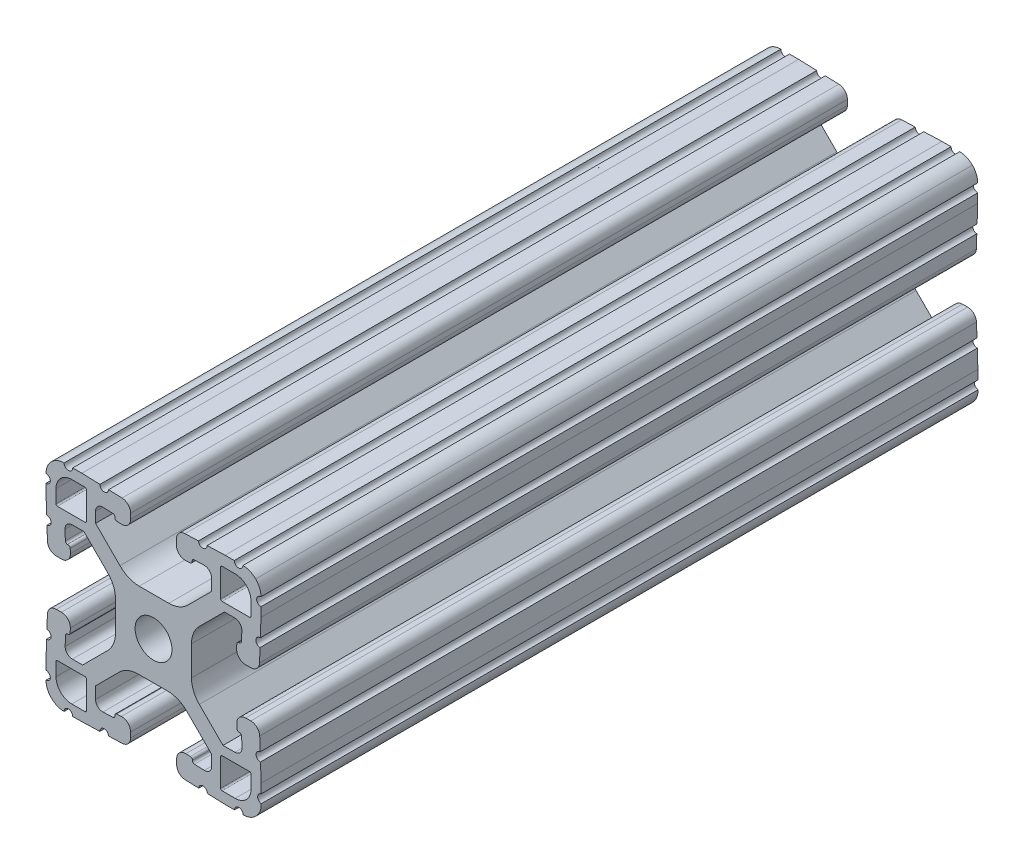
from build123d import *

# Parameters (mm, degrees)
SKETCH1_R           = 3.2639
BOSS_EXTRUDE1_DEPTH = 127


with BuildPart() as part:
    # Sketch1 → Boss-Extrude1 (new body)
    with BuildSketch(Plane(origin=(0, 0, -25.4), x_dir=(-1, 0, 0), z_dir=(0, 0, -1))):
        with BuildLine():
            Line((-88.043721549, 91.862643967), (-86.29674679, 91.923648859))
            ThreePointArc((-86.29674679, 91.923648859), (-85.370208675, 91.567983831), (-84.982425017, 90.654422489))
            Line((-84.982425017, 90.654422489), (-84.982425017, 88.800173916))
            Line((-84.982425017, 88.800173916), (-89.306565884, 84.476033049))
            ThreePointArc((-89.306565884, 84.476033049), (-90.866149908, 83.406077005), (-92.719610366, 83.029523439))
            Line((-92.719610366, 83.029523439), (-97.961628589, 83.029523439))
            ThreePointArc((-97.961628589, 83.029523439), (-99.779298356, 83.391080435), (-101.320244378, 84.42070765))
            Line((-101.320244378, 84.42070765), (-105.516001761, 88.616465033))
            Line((-105.516001761, 88.616465033), (-105.516001761, 90.731330035))
            ThreePointArc((-105.516001761, 90.731330035), (-105.128218103, 91.644891377), (-104.201679988, 92.000556406))
            Line((-104.201679988, 92.000556406), (-102.454705229, 91.939551513))
            ThreePointArc((-102.454705229, 91.939551513), (-102.193933359, 91.823448504), (-102.087001761, 91.558783602))
            ThreePointArc((-102.087001761, 91.558783602), (-102.010859042, 91.249291513), (-101.726191901, 91.105946874))
            Line((-101.726191901, 91.105946874), (-100.929727576, 91.078102142))
            ThreePointArc((-100.929727576, 91.078102142), (-99.780779944, 91.519102656), (-99.299905511, 92.651940638))
            Line((-99.299905511, 92.651940638), (-99.299905511, 93.566848638))
            ThreePointArc((-99.299905511, 93.566848638), (-99.741889517, 94.660796975), (-100.819746715, 95.140689345))
            Line((-100.819746715, 95.140689345), (-103.211918901, 95.224224422))
            ThreePointArc((-103.211918901, 95.224224422), (-104.000045777, 94.489281495), (-104.734990687, 95.277406522))
            Line((-104.734990687, 95.277406522), (-107.935905676, 95.389166912))
            Line((-107.935905676, 95.389166912), (-109.561454876, 95.389166912))
            ThreePointArc((-109.561454876, 95.389166912), (-110.323454876, 94.627166912), (-111.085454876, 95.389166912))
            ThreePointArc((-111.085454876, 95.389166912), (-112.308767787, 95.144035599), (-113.343184761, 94.446493225))
            ThreePointArc((-113.343184761, 94.446493225), (-114.04072548, 93.412075135), (-114.285854836, 92.188761832))
            ThreePointArc((-114.285854836, 92.188761832), (-113.523853616, 91.426762441), (-114.285853616, 90.664761832))
            Line((-114.285853616, 90.664761832), (-114.285853616, 89.039212632))
            Line((-114.285853616, 89.039212632), (-114.174093219, 85.838297643))
            ThreePointArc((-114.174093219, 85.838297643), (-113.385968191, 85.103352735), (-114.120911115, 84.315225857))
            Line((-114.120911115, 84.315225857), (-114.037376031, 81.923053667))
            ThreePointArc((-114.037376031, 81.923053667), (-113.55748366, 80.845196472), (-112.463535325, 80.403212468))
            Line((-112.463535325, 80.403212468), (-111.548627325, 80.403212468))
            ThreePointArc((-111.548627325, 80.403212468), (-110.415788905, 80.884087354), (-109.974788872, 82.033035791))
            Line((-109.974788872, 82.033035791), (-110.002634241, 82.829500094))
            ThreePointArc((-110.002634241, 82.829500094), (-110.118742417, 83.090261917), (-110.383401914, 83.197188))
            ThreePointArc((-110.383401914, 83.197188), (-110.693757401, 83.272605688), (-110.837665276, 83.557735272))
            Line((-110.837665276, 83.557735272), (-110.898671566, 85.304709982))
            ThreePointArc((-110.898671566, 85.304709982), (-110.543006925, 86.231248747), (-109.62944523, 86.61903277))
            Line((-109.62944523, 86.61903277), (-107.807161806, 86.61903277))
            Line((-107.807161806, 86.61903277), (-103.364925613, 82.176810793))
            ThreePointArc((-103.364925613, 82.176810793), (-102.335294479, 80.635862907), (-101.973736029, 78.81818963))
            Line((-101.973736029, 78.81818963), (-101.973736029, 73.576034207))
            ThreePointArc((-101.973736029, 73.576034207), (-102.335293752, 71.758362684), (-103.364922926, 70.21741573))
            Line((-103.364922926, 70.21741573), (-107.560683666, 66.021661704))
            Line((-107.560683666, 66.021661704), (-109.652436558, 66.021661704))
            ThreePointArc((-109.652436558, 66.021661704), (-110.565998503, 66.409445617), (-110.921663765, 67.335984343))
            Line((-110.921663765, 67.335984343), (-110.860658873, 69.082959102))
            ThreePointArc((-110.860658873, 69.082959102), (-110.744555864, 69.343730973), (-110.479890961, 69.45066257))
            ThreePointArc((-110.479890961, 69.45066257), (-110.173494703, 69.529390272), (-110.032185196, 69.812424443))
            Line((-110.032185196, 69.812424443), (-110.004340464, 70.608888768))
            ThreePointArc((-110.004340464, 70.608888768), (-110.445340978, 71.7578364), (-111.57817896, 72.238710833))
            Line((-111.57817896, 72.238710833), (-112.49308696, 72.238710833))
            ThreePointArc((-112.49308696, 72.238710833), (-113.587035297, 71.796726827), (-114.066927667, 70.718869629))
            Line((-114.066927667, 70.718869629), (-114.150462744, 68.326697443))
            ThreePointArc((-114.150462744, 68.326697443), (-113.415519817, 67.538570567), (-114.203644843, 66.803625657))
            Line((-114.203644843, 66.803625657), (-114.315405233, 63.602710668))
            Line((-114.315405233, 63.602710668), (-114.315405233, 61.962557497))
            ThreePointArc((-114.315405233, 61.962557497), (-113.701927281, 61.206106537), (-114.333208228, 60.464447842))
            ThreePointArc((-114.333208228, 60.464447842), (-114.113020459, 59.176546471), (-113.392816136, 58.086372941))
            ThreePointArc((-113.392816136, 58.086372941), (-112.358398046, 57.388832223), (-111.135084743, 57.143702867))
            ThreePointArc((-111.135084743, 57.143702867), (-110.373085352, 57.905704086), (-109.611084743, 57.143704086))
            Line((-109.611084743, 57.143704086), (-107.985535543, 57.143704086))
            Line((-107.985535543, 57.143704086), (-104.784620554, 57.255464483))
            ThreePointArc((-104.784620554, 57.255464483), (-104.049675645, 58.04358951), (-103.261548768, 57.308646586))
            Line((-103.261548768, 57.308646586), (-100.869376578, 57.39218167))
            ThreePointArc((-100.869376578, 57.39218167), (-99.791519383, 57.872074041), (-99.349535378, 58.966022376))
            Line((-99.349535378, 58.966022376), (-99.349535378, 59.880930376))
            ThreePointArc((-99.349535378, 59.880930376), (-99.830409811, 61.013768358), (-100.979357443, 61.454768873))
            Line((-100.979357443, 61.454768873), (-101.775821768, 61.42692414))
            ThreePointArc((-101.775821768, 61.42692414), (-102.036583684, 61.310816174), (-102.143509978, 61.046156762))
            ThreePointArc((-102.143509978, 61.046156762), (-102.222494916, 60.740061862), (-102.505377386, 60.598958297))
            Line((-102.505377386, 60.598958297), (-104.252352145, 60.537953405))
            ThreePointArc((-104.252352145, 60.537953405), (-105.17889026, 60.893618433), (-105.566673918, 61.807179775))
            Line((-105.566673918, 61.807179775), (-105.566673918, 63.629462758))
            Line((-105.566673918, 63.629462758), (-101.131142468, 68.064994208))
            ThreePointArc((-101.131142468, 68.064994208), (-99.590196446, 69.094621422), (-97.772526678, 69.456178419))
            Line((-97.772526678, 69.456178419), (-92.530356056, 69.456178419))
            ThreePointArc((-92.530356056, 69.456178419), (-90.712686289, 69.094621422), (-89.171740267, 68.064994208))
            Line((-89.171740267, 68.064994208), (-84.975982884, 63.869236825))
            Line((-84.975982884, 63.869236825), (-84.975982884, 61.781050107))
            ThreePointArc((-84.975982884, 61.781050107), (-85.363766542, 60.867488765), (-86.290304657, 60.511823736))
            Line((-86.290304657, 60.511823736), (-88.037279416, 60.572828629))
            ThreePointArc((-88.037279416, 60.572828629), (-88.298051286, 60.688931638), (-88.404982884, 60.95359654))
            ThreePointArc((-88.404982884, 60.95359654), (-88.466593694, 61.278962759), (-88.759626911, 61.433204782))
            Line((-88.759626911, 61.433204782), (-89.556091237, 61.461049514))
            ThreePointArc((-89.556091237, 61.461049514), (-90.705038868, 61.020049), (-91.185913301, 59.887211018))
            Line((-91.185913301, 59.887211018), (-91.185913301, 58.972303018))
            ThreePointArc((-91.185913301, 58.972303018), (-90.743929295, 57.878354681), (-89.666072098, 57.398462311))
            Line((-89.666072098, 57.398462311), (-87.273899911, 57.314927234))
            ThreePointArc((-87.273899911, 57.314927234), (-86.485773036, 58.049870161), (-85.750828126, 57.261745135))
            Line((-85.750828126, 57.261745135), (-82.549913136, 57.149984745))
            Line((-82.549913136, 57.149984745), (-80.924363936, 57.149984745))
            ThreePointArc((-80.924363936, 57.149984745), (-80.162363936, 57.911984745), (-79.400363936, 57.149984745))
            ThreePointArc((-79.400363936, 57.149984745), (-78.177051025, 57.395116058), (-77.142634052, 58.092658432))
            ThreePointArc((-77.142634052, 58.092658432), (-76.445094372, 59.127074031), (-76.199963977, 60.350384428))
            ThreePointArc((-76.199963977, 60.350384428), (-76.961961268, 61.112385783), (-76.199961268, 61.874384428))
            Line((-76.199961268, 61.874384428), (-76.199961268, 63.499933628))
            Line((-76.199961268, 63.499933628), (-76.311721666, 66.700848617))
            ThreePointArc((-76.311721666, 66.700848617), (-77.099846694, 67.435793525), (-76.364903769, 68.223920403))
            Line((-76.364903769, 68.223920403), (-76.448438853, 70.616092593))
            ThreePointArc((-76.448438853, 70.616092593), (-76.928331225, 71.693949788), (-78.02227956, 72.135933792))
            Line((-78.02227956, 72.135933792), (-78.93718756, 72.135933792))
            ThreePointArc((-78.93718756, 72.135933792), (-80.07002598, 71.655058906), (-80.511026012, 70.506110469))
            Line((-80.511026012, 70.506110469), (-80.483180643, 69.709646166))
            ThreePointArc((-80.483180643, 69.709646166), (-80.367072468, 69.448884343), (-80.102412971, 69.34195826))
            ThreePointArc((-80.102412971, 69.34195826), (-79.796317908, 69.262973649), (-79.655214052, 68.980091239))
            Line((-79.655214052, 68.980091239), (-79.594207761, 67.233116529))
            ThreePointArc((-79.594207761, 67.233116529), (-79.949872402, 66.306577764), (-80.863434097, 65.918793741))
            Line((-80.863434097, 65.918793741), (-82.685717521, 65.918793741))
            Line((-82.685717521, 65.918793741), (-87.121258001, 70.35431293))
            ThreePointArc((-87.121258001, 70.35431293), (-88.150863946, 71.895196205), (-88.512450271, 73.712794894))
            Line((-88.512450271, 73.712794894), (-88.512606864, 78.954950317))
            ThreePointArc((-88.512606864, 78.954950317), (-88.151076291, 80.772698182), (-87.121419968, 82.313710679))
            Line((-87.121419968, 82.313710679), (-82.925659228, 86.509464706))
            Line((-82.925659228, 86.509464706), (-80.837473527, 86.509464706))
            ThreePointArc((-80.837473527, 86.509464706), (-79.923911584, 86.121680793), (-79.568246321, 85.195142068))
            Line((-79.568246321, 85.195142068), (-79.629251214, 83.448167309))
            ThreePointArc((-79.629251214, 83.448167309), (-79.745354223, 83.187395438), (-80.010019125, 83.080463841))
            ThreePointArc((-80.010019125, 83.080463841), (-80.335385344, 83.018853031), (-80.489627367, 82.725819813))
            Line((-80.489627367, 82.725819813), (-80.5174721, 81.929355488))
            ThreePointArc((-80.5174721, 81.929355488), (-80.076471586, 80.780407856), (-78.943633603, 80.299533423))
            Line((-78.943633603, 80.299533423), (-78.028725603, 80.299533423))
            ThreePointArc((-78.028725603, 80.299533423), (-76.934777267, 80.741517429), (-76.454884897, 81.819374627))
            Line((-76.454884897, 81.819374627), (-76.37134982, 84.211546813))
            ThreePointArc((-76.37134982, 84.211546813), (-77.106292747, 84.999673689), (-76.31816772, 85.734618599))
            Line((-76.31816772, 85.734618599), (-76.20640733, 88.935533588))
            Line((-76.20640733, 88.935533588), (-76.20640733, 90.561082788))
            ThreePointArc((-76.20640733, 90.561082788), (-76.96840733, 91.323083398), (-76.206406111, 92.085082788))
            ThreePointArc((-76.206406111, 92.085082788), (-76.451535467, 93.308396091), (-77.149076185, 94.342814181))
            ThreePointArc((-77.149076185, 94.342814181), (-78.183493159, 95.040356555), (-79.40680607, 95.285487868))
            ThreePointArc((-79.40680607, 95.285487868), (-80.16880607, 94.523487868), (-80.93080607, 95.285487868))
            Line((-80.93080607, 95.285487868), (-82.55635527, 95.285487868))
            Line((-82.55635527, 95.285487868), (-85.757270259, 95.173727471))
            ThreePointArc((-85.757270259, 95.173727471), (-86.492215168, 94.385602444), (-87.280342045, 95.120545368))
            Line((-87.280342045, 95.120545368), (-89.672514235, 95.037010285))
            ThreePointArc((-89.672514235, 95.037010285), (-90.75037143, 94.557117913), (-91.192355435, 93.463169578))
            Line((-91.192355435, 93.463169578), (-91.192355435, 92.548261578))
            ThreePointArc((-91.192355435, 92.548261578), (-90.711481002, 91.415423596), (-89.56253337, 90.974423082))
            Line((-89.56253337, 90.974423082), (-88.766069045, 91.002267814))
            ThreePointArc((-88.766069045, 91.002267814), (-88.505307129, 91.11837578), (-88.398380835, 91.383035192))
            ThreePointArc((-88.398380835, 91.383035192), (-88.336765486, 91.708407548), (-88.043721549, 91.862643967))
        make_face()
        with Locations(Location((-95.25, 76.2, 0), (0, 0, 180))):
            Circle(SKETCH1_R, mode=Mode.SUBTRACT)
        with BuildLine():
            Line((-83.357745393, 88.294108398), (-83.357745393, 93.170908398))
            ThreePointArc((-83.357745393, 93.170908398), (-83.283351492, 93.350512545), (-83.103748154, 93.424908398))
            Line((-83.103748154, 93.424908398), (-80.766975763, 93.424933798))
            ThreePointArc((-80.766975763, 93.424933798), (-78.791299784, 92.606600882), (-77.972945393, 90.630933798))
            Line((-77.972945393, 90.630933798), (-77.972945393, 88.294108398))
            ThreePointArc((-77.972945393, 88.294108398), (-78.047340271, 88.114503276), (-78.226945393, 88.040108398))
            Line((-78.226945393, 88.040108398), (-83.103745393, 88.040108398))
            ThreePointArc((-83.103745393, 88.040108398), (-83.283350516, 88.114503276), (-83.357745393, 88.294108398))
        make_face(mode=Mode.SUBTRACT)
        with BuildLine():
            Line((-83.357745393, 59.229091602), (-83.357745393, 64.105891602))
            ThreePointArc((-83.357745393, 64.105891602), (-83.283350516, 64.285496724), (-83.103745393, 64.359891602))
            Line((-83.103745393, 64.359891602), (-78.226945393, 64.359891602))
            ThreePointArc((-78.226945393, 64.359891602), (-78.047340271, 64.285496724), (-77.972945393, 64.105891602))
            Line((-77.972945393, 64.105891602), (-77.972945393, 61.769066202))
            ThreePointArc((-77.972945393, 61.769066202), (-78.791299784, 59.793399118), (-80.766975763, 58.975066202))
            Line((-80.766975763, 58.975066202), (-83.103748154, 58.975091602))
            ThreePointArc((-83.103748154, 58.975091602), (-83.283351492, 59.049487455), (-83.357745393, 59.229091602))
        make_face(mode=Mode.SUBTRACT)
        with BuildLine():
            Line((-107.142254607, 93.170908398), (-107.142254607, 88.294108398))
            ThreePointArc((-107.142254607, 88.294108398), (-107.216649484, 88.114503276), (-107.396254607, 88.040108398))
            Line((-107.396254607, 88.040108398), (-112.273054607, 88.040108398))
            ThreePointArc((-112.273054607, 88.040108398), (-112.452659729, 88.114503276), (-112.527054607, 88.294108398))
            Line((-112.527054607, 88.294108398), (-112.527054607, 90.630933798))
            ThreePointArc((-112.527054607, 90.630933798), (-111.708700216, 92.606600882), (-109.733024237, 93.424933798))
            Line((-109.733024237, 93.424933798), (-107.396251846, 93.424908398))
            ThreePointArc((-107.396251846, 93.424908398), (-107.216648508, 93.350512545), (-107.142254607, 93.170908398))
        make_face(mode=Mode.SUBTRACT)
        with BuildLine():
            Line((-107.142254607, 64.105891602), (-107.142254607, 59.229091602))
            ThreePointArc((-107.142254607, 59.229091602), (-107.216648508, 59.049487455), (-107.396251846, 58.975091602))
            Line((-107.396251846, 58.975091602), (-109.733024237, 58.975066202))
            ThreePointArc((-109.733024237, 58.975066202), (-111.708700216, 59.793399118), (-112.527054607, 61.769066202))
            Line((-112.527054607, 61.769066202), (-112.527054607, 64.105891602))
            ThreePointArc((-112.527054607, 64.105891602), (-112.452659729, 64.285496724), (-112.273054607, 64.359891602))
            Line((-112.273054607, 64.359891602), (-107.396254607, 64.359891602))
            ThreePointArc((-107.396254607, 64.359891602), (-107.216649484, 64.285496724), (-107.142254607, 64.105891602))
        make_face(mode=Mode.SUBTRACT)
    extrude(amount=-BOSS_EXTRUDE1_DEPTH)


solid = part.part
